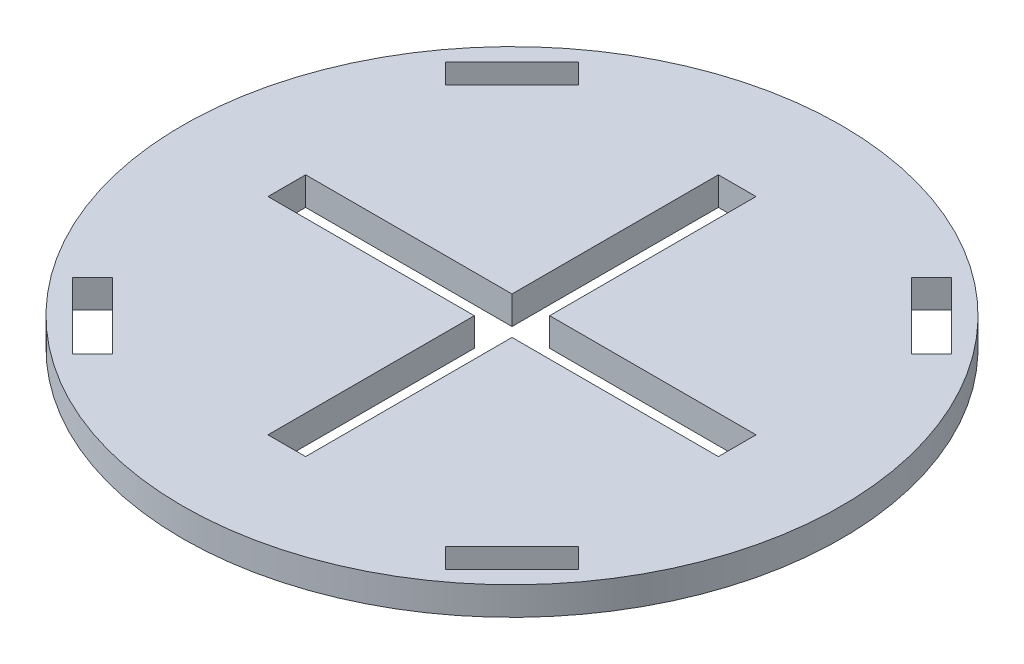
from build123d import *

# Parameters (mm, degrees)
SKICA1_R                 = 35
P_IDAT_VYSUNUT_M1_DEPTH  = 3
ODEBRAT_VYSUNUT_M1_DEPTH = 3
ODEBRAT_VYSUNUT_M3_DEPTH = 3


with BuildPart() as part:
    # Skica1 → Přidat vysunutím1 (new body)
    with BuildSketch(Plane(origin=(0, 0, 0), x_dir=(1, 0, 0), z_dir=(0, 1, 0))):
        with Locations(Location((0, 0, 0), (0, 0, 270))):
            Circle(SKICA1_R)
    extrude(amount=P_IDAT_VYSUNUT_M1_DEPTH)

    # Skica2 → Odebrat vysunutím1 (cut)
    with BuildSketch(Plane(origin=(0, 3, 0), x_dir=(1, 0, 0), z_dir=(0, 1, 0))):
        Polygon((2, 23.916521486), (2, 2), (23.916521486, 2), (23.916521486, -2), (2, -2), (2, -23.916521486), (-2, -23.916521486), (-2, -2), (-23.916521486, -2), (-23.916521486, 2), (-2, 2), (-2, 23.916521486), align=None)
    extrude(amount=-ODEBRAT_VYSUNUT_M1_DEPTH, mode=Mode.SUBTRACT)

    # Skica3 → Odebrat vysunutím3 (cut)
    with BuildSketch(Plane(origin=(0, 3, 0), x_dir=(1, 0, 0), z_dir=(0, 1, 0))):
        Polygon((19.798989873, 26.870057685), (26.870057685, 19.798989873), (24.748737342, 17.67766953), (17.67766953, 24.748737342), align=None)
        Polygon((26.870057685, -19.798989873), (19.798989873, -26.870057685), (17.67766953, -24.748737342), (24.748737342, -17.67766953), align=None)
        Polygon((-19.798989873, -26.870057685), (-26.870057685, -19.798989873), (-24.748737342, -17.67766953), (-17.67766953, -24.748737342), align=None)
        Polygon((-26.870057685, 19.798989873), (-19.798989873, 26.870057685), (-17.67766953, 24.748737342), (-24.748737342, 17.67766953), align=None)
    extrude(amount=-ODEBRAT_VYSUNUT_M3_DEPTH, mode=Mode.SUBTRACT)


solid = part.part
